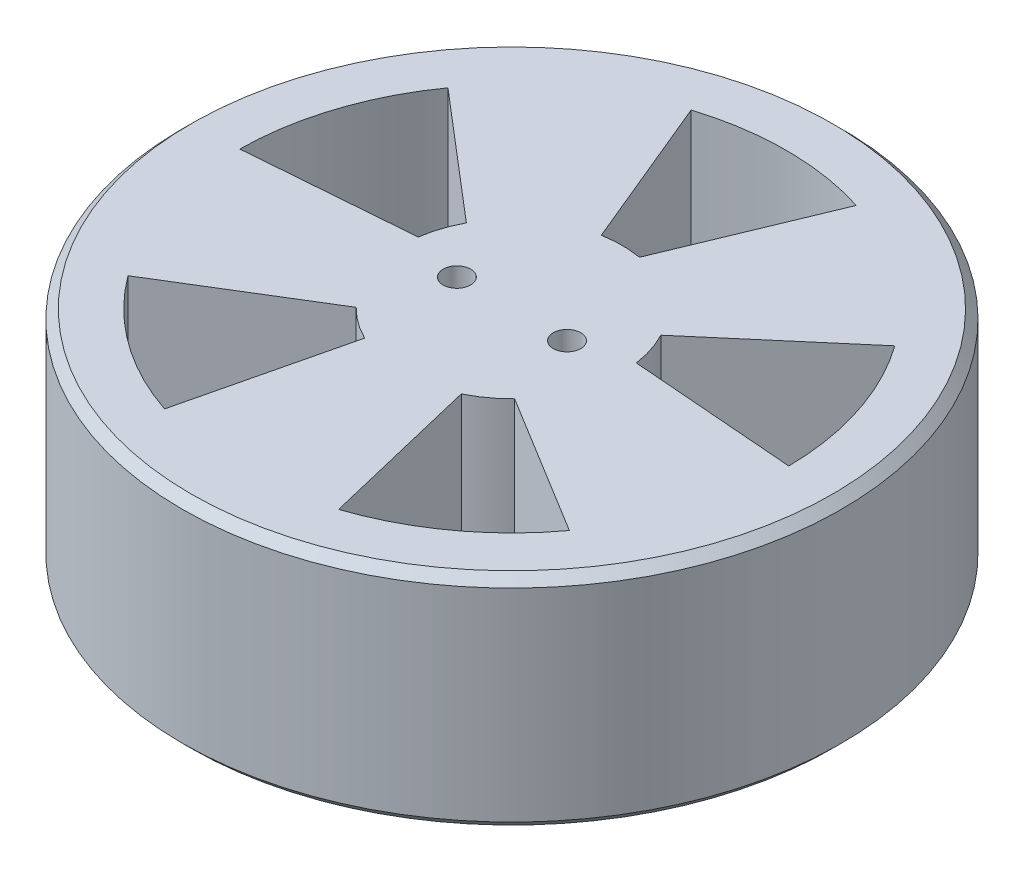
from build123d import *

# Parameters (mm, degrees)
SKETCH1_R               = 76.0095
BOSS_EXTRUDE1_DEPTH     = 50.8
CHAMFER1_SIZE           = 2.032
CUT_EXTRUDE1_DEPTH      = 119.892927378
CUT_EXTRUDE1_DEPTH_BACK = 119.892927378
SKETCH2_R               = 3.175
CUT_EXTRUDE2_DEPTH      = 119.892927378
CUT_EXTRUDE2_DEPTH_BACK = 119.892927378


with BuildPart() as part:
    # Sketch1 → Boss-Extrude1 (new body)
    with BuildSketch(Plane(origin=(0, 0, 0), x_dir=(1, 0, 0), z_dir=(0, 1, 0))):
        with Locations(Location((0, 0, 0), (0, 0, 270))):
            Circle(SKETCH1_R)
    extrude(amount=BOSS_EXTRUDE1_DEPTH)

    # Chamfer1
    chamfer1_edges = [part.edges().sort_by_distance(p)[0] for p in [
        (0, 0, -76.0095),
        (0, 50.8, -76.0095),
    ]]
    chamfer(chamfer1_edges, length=CHAMFER1_SIZE)

    # Sketch2 → Cut-Extrude1 (cut, two sides: drawn at the far end of the back side and taken through both)
    with BuildSketch(Plane(origin=(0, 50.8, 0), x_dir=(1, 0, 0), z_dir=(0, 1, 0)).offset(-CUT_EXTRUDE1_DEPTH_BACK)):
        with Locations(Location((-12.7, 0, 0), (0, 0, 270))):
            Circle(SKETCH2_R)
        with Locations(Location((12.7, 0, 0), (0, 0, 270))):
            Circle(SKETCH2_R)
    extrude(amount=CUT_EXTRUDE1_DEPTH + CUT_EXTRUDE1_DEPTH_BACK, mode=Mode.SUBTRACT)

    # Sketch3 → Cut-Extrude2 (cut, two sides: drawn at the far end of the back side and taken through both)
    with BuildSketch(Plane(origin=(0, 50.8, 0), x_dir=(1, 0, 0), z_dir=(0, 1, 0)).offset(-CUT_EXTRUDE2_DEPTH_BACK)):
        with BuildLine():
            Line((-4.403402195, 25.015396241), (-19.05, 60.375411305))
            ThreePointArc((-19.05, 60.375411305), (0, 63.3095), (19.05, 60.375411305))
            Line((19.05, 60.375411305), (4.403402195, 25.015396241))
            ThreePointArc((4.403402195, 25.015396241), (0, 25.4), (-4.403402195, 25.015396241))
        make_face()
        with BuildLine():
            Line((22.430329492, 11.918066911), (51.533654603, 36.774654771))
            ThreePointArc((51.533654603, 36.774654771), (60.210912518, 19.563711405), (63.307202088, 0.5394015))
            Line((63.307202088, 0.5394015), (25.151781714, 3.542298208))
            ThreePointArc((25.151781714, 3.542298208), (24.156835514, 7.849031657), (22.430329492, 11.918066911))
        make_face()
        with BuildLine():
            Line((18.2661082, -17.64962581), (50.899550109, -37.647424732))
            ThreePointArc((50.899550109, -37.647424732), (37.21239043, -51.218461405), (20.076002623, -60.042042844))
            Line((20.076002623, -60.042042844), (11.141253782, -22.82613555))
            ThreePointArc((11.141253782, -22.82613555), (14.929745408, -20.549031657), (18.2661082, -17.64962581))
        make_face()
        with BuildLine():
            Line((-11.141253782, -22.82613555), (-20.076002623, -60.042042844))
            ThreePointArc((-20.076002623, -60.042042844), (-37.21239043, -51.218461405), (-50.899550109, -37.647424732))
            Line((-50.899550109, -37.647424732), (-18.2661082, -17.64962581))
            ThreePointArc((-18.2661082, -17.64962581), (-14.929745408, -20.549031657), (-11.141253782, -22.82613555))
        make_face()
        with BuildLine():
            Line((-25.151781714, 3.542298208), (-63.307202088, 0.5394015))
            ThreePointArc((-63.307202088, 0.5394015), (-60.210912518, 19.563711405), (-51.533654603, 36.774654771))
            Line((-51.533654603, 36.774654771), (-22.430329492, 11.918066911))
            ThreePointArc((-22.430329492, 11.918066911), (-24.156835514, 7.849031657), (-25.151781714, 3.542298208))
        make_face()
    extrude(amount=CUT_EXTRUDE2_DEPTH + CUT_EXTRUDE2_DEPTH_BACK, mode=Mode.SUBTRACT)


solid = part.part
